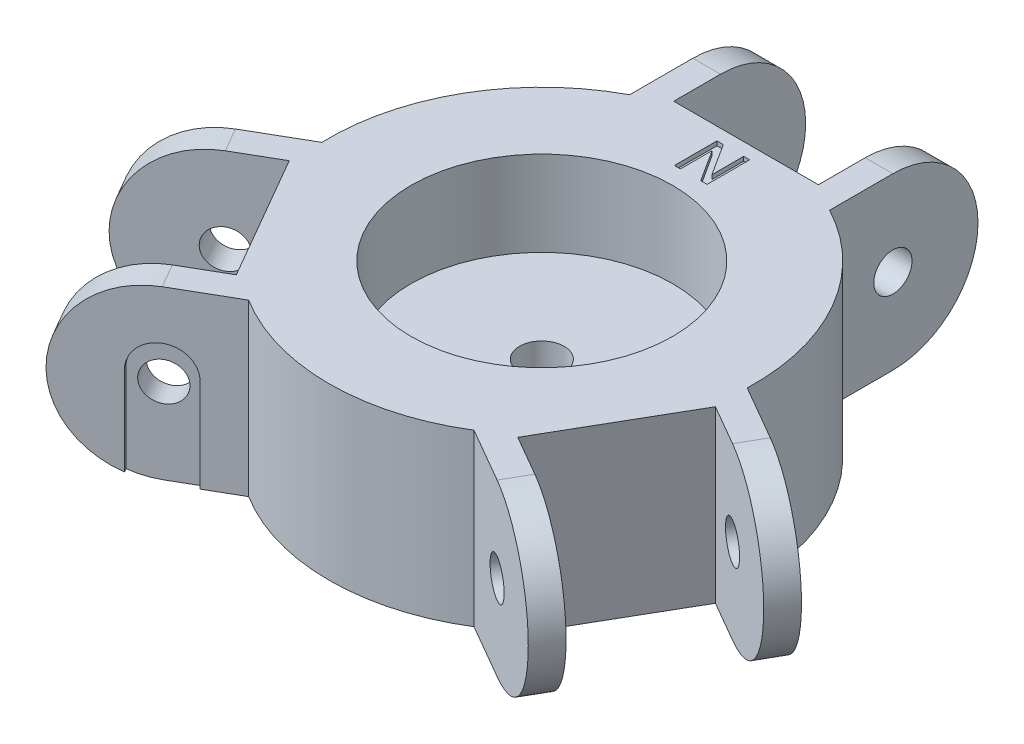
from build123d import *

# Parameters (mm, degrees)
SKETCH1_R                    = 50
BOSS_EXTRUDE1_DEPTH          = 40
SKETCH2_R                    = 30.75
CUT_EXTRUDE1_DEPTH           = 20
F_10_5_10_5_DIAMETER_HOLE1_D = 10.5
CUT_EXTRUDE2_DEPTH           = 82.240384046
BOSS_EXTRUDE2_START          = -3.866679
SKETCH6_W                    = 47
SKETCH6_H                    = 40
BOSS_EXTRUDE2_DEPTH          = 3.866679
BOSS_EXTRUDE3_DEPTH          = 6.5
F_9_0_9_DIAMETER_HOLE1_D     = 9
CUT_EXTRUDE3_DEPTH           = 1
CIRPATTERN1_COUNT            = 3
CIRPATTERN1_COPY_1_DEPTH     = 6.5
CIRPATTERN1_COPY_2_DEPTH     = 6.5
CIRPATTERN1_COPY_3_D         = 9
CIRPATTERN1_COPY_4_D         = 9
CUT_EXTRUDE4_DEPTH           = 1


with BuildPart() as part:
    # Sketch1 → Boss-Extrude1 (new body)
    with BuildSketch(Plane(origin=(0, 0, 0), x_dir=(1, 0, 0), z_dir=(0, 1, 0))):
        with Locations(Location((0, 0, 0), (0, 0, 270))):
            Circle(SKETCH1_R)
    extrude(amount=BOSS_EXTRUDE1_DEPTH)

    # Sketch2 → Cut-Extrude1 (cut)
    with BuildSketch(Plane(origin=(0, 40, 0), x_dir=(1, 0, 0), z_dir=(0, 1, 0))):
        with Locations(Location((0, 0, 0), (0, 0, 270))):
            Circle(SKETCH2_R)
    extrude(amount=-CUT_EXTRUDE1_DEPTH, mode=Mode.SUBTRACT)

    # Ø10.5 (10.5) Diameter Hole1 (through all)
    with Locations(Plane(origin=(0, 20, 0), x_dir=(1, 0, 0), z_dir=(0, 1, 0))):
        with Locations((0, 0)):
            Hole(F_10_5_10_5_DIAMETER_HOLE1_D / 2)

    # Sketch5 → Cut-Extrude2 (cut, through all)
    with BuildSketch(Plane(origin=(0, 40, 0), x_dir=(1, 0, 0), z_dir=(0, 1, 0))):
        with BuildLine():
            Line((-14, 48), (14, 48))
            ThreePointArc((14, 48), (0, 50), (-14, 48))
        make_face()
    cut_extrude2 = extrude(amount=-CUT_EXTRUDE2_DEPTH, mode=Mode.SUBTRACT)

    # Sketch6 → Boss-Extrude2 (add)
    with BuildSketch(Plane(origin=(0, 0, -48), x_dir=(-1, 0, 0), z_dir=(0, 0, -1)).offset(BOSS_EXTRUDE2_START)):
        with Locations((0, 20)):
            Rectangle(SKETCH6_W, SKETCH6_H)
    boss_extrude2 = extrude(amount=BOSS_EXTRUDE2_DEPTH)

    # Sketch7 → Boss-Extrude3 (add)
    with BuildSketch(Plane.ZY.offset(23.5)):
        with BuildLine():
            Line((-59, 40), (-48, 40))
            Line((-48, 40), (-48, 0))
            Line((-48, 0), (-59, 0))
            ThreePointArc((-59, 0), (-79, 20), (-59, 40))
        make_face()
    boss_extrude3 = extrude(amount=-BOSS_EXTRUDE3_DEPTH)

    # Ø9.0 (9) Diameter Hole1 (through all)
    with Locations(Plane.ZY.offset(23.5)):
        with Locations((-59, 20)):
            f_9_0_9_diameter_hole1 = Hole(F_9_0_9_DIAMETER_HOLE1_D / 2)

    # Mirror1: Boss-Extrude3, Ø9.0 (9) Diameter Hole1 across plane
    add(boss_extrude3.mirror(Plane(origin=(0, 0, 0), x_dir=(0, 0, 1), z_dir=(1, 0, 0))))
    add(f_9_0_9_diameter_hole1.mirror(Plane(origin=(0, 0, 0), x_dir=(0, 0, 1), z_dir=(1, 0, 0))), mode=Mode.SUBTRACT)

    # Sketch10 → Cut-Extrude3 (cut)
    with BuildSketch(Plane.ZY.offset(23.5)):
        with BuildLine():
            Line((-65.5, 22), (-65.5, 0))
            Line((-65.5, 0), (-52.5, 0))
            Line((-52.5, 0), (-52.5, 22))
            ThreePointArc((-52.5, 22), (-59, 28.5), (-65.5, 22))
        make_face()
    cut_extrude3 = extrude(amount=-CUT_EXTRUDE3_DEPTH, mode=Mode.SUBTRACT)

    # CirPattern1: Cut-Extrude2, Boss-Extrude2, Boss-Extrude3, Ø9.0 (9) Diameter Hole1, Cut-Extrude3 ×3 about axis
    cirpattern1_axis = Axis((0, 0, 0), (0, 1, 0))
    add([cut_extrude2.rotate(cirpattern1_axis, i * 360 / CIRPATTERN1_COUNT) for i in range(1, CIRPATTERN1_COUNT)], mode=Mode.SUBTRACT)
    add([boss_extrude2.rotate(cirpattern1_axis, i * 360 / CIRPATTERN1_COUNT) for i in range(1, CIRPATTERN1_COUNT)])
    add([boss_extrude3.rotate(cirpattern1_axis, i * 360 / CIRPATTERN1_COUNT) for i in range(1, CIRPATTERN1_COUNT)])
    add([f_9_0_9_diameter_hole1.rotate(cirpattern1_axis, i * 360 / CIRPATTERN1_COUNT) for i in range(1, CIRPATTERN1_COUNT)], mode=Mode.SUBTRACT)
    add([cut_extrude3.rotate(cirpattern1_axis, i * 360 / CIRPATTERN1_COUNT) for i in range(1, CIRPATTERN1_COUNT)], mode=Mode.SUBTRACT)

    # CirPattern1 copy 1 sketch → CirPattern1 copy 1 (add)
    with BuildSketch(Plane(origin=(-11.75, 0, -20.351596989), x_dir=(0.8660254037844387, 0, -0.4999999999999998), z_dir=(-0.4999999999999998, 0, -0.8660254037844387))):
        with BuildLine():
            Line((-59, -40), (-48, -40))
            Line((-48, -40), (-48, 0))
            Line((-48, 0), (-59, 0))
            ThreePointArc((-59, 0), (-79, -20), (-59, -40))
        make_face()
    extrude(amount=-CIRPATTERN1_COPY_1_DEPTH)

    # CirPattern1 copy 2 sketch → CirPattern1 copy 2 (add)
    with BuildSketch(Plane(origin=(-11.75, 0, 20.351596989), x_dir=(-0.8660254037844384, 0, -0.5000000000000004), z_dir=(-0.5000000000000004, 0, 0.8660254037844384))):
        with BuildLine():
            Line((-59, -40), (-48, -40))
            Line((-48, -40), (-48, 0))
            Line((-48, 0), (-59, 0))
            ThreePointArc((-59, 0), (-79, -20), (-59, -40))
        make_face()
    extrude(amount=-CIRPATTERN1_COPY_2_DEPTH)

    # CirPattern1 copy 3 (through all)
    with Locations(Plane(origin=(-11.75, 0, -20.351596989), x_dir=(0.8660254037844387, 0, -0.4999999999999998), z_dir=(-0.4999999999999998, 0, -0.8660254037844387))):
        with Locations((-59, -20)):
            Hole(CIRPATTERN1_COPY_3_D / 2)

    # CirPattern1 copy 4 (through all)
    with Locations(Plane(origin=(-11.75, 0, 20.351596989), x_dir=(-0.8660254037844384, 0, -0.5000000000000004), z_dir=(-0.5000000000000004, 0, 0.8660254037844384))):
        with Locations((-59, -20)):
            Hole(CIRPATTERN1_COPY_4_D / 2)

    # Sketch11 → Cut-Extrude4 (cut)
    with BuildSketch(Plane(origin=(0, 40, 0), x_dir=(1, 0, 0), z_dir=(0, 1, 0))):
        Polygon((-3.846153846, 35), (-3.846153846, 45), (-2.355769231, 45), (2.435897436, 37.538060897), (2.435897436, 45), (3.846153846, 45), (3.846153846, 35), (2.355769231, 35), (-2.435897436, 42.461939103), (-2.435897436, 35), align=None)
    extrude(amount=-CUT_EXTRUDE4_DEPTH, mode=Mode.SUBTRACT)


solid = part.part
